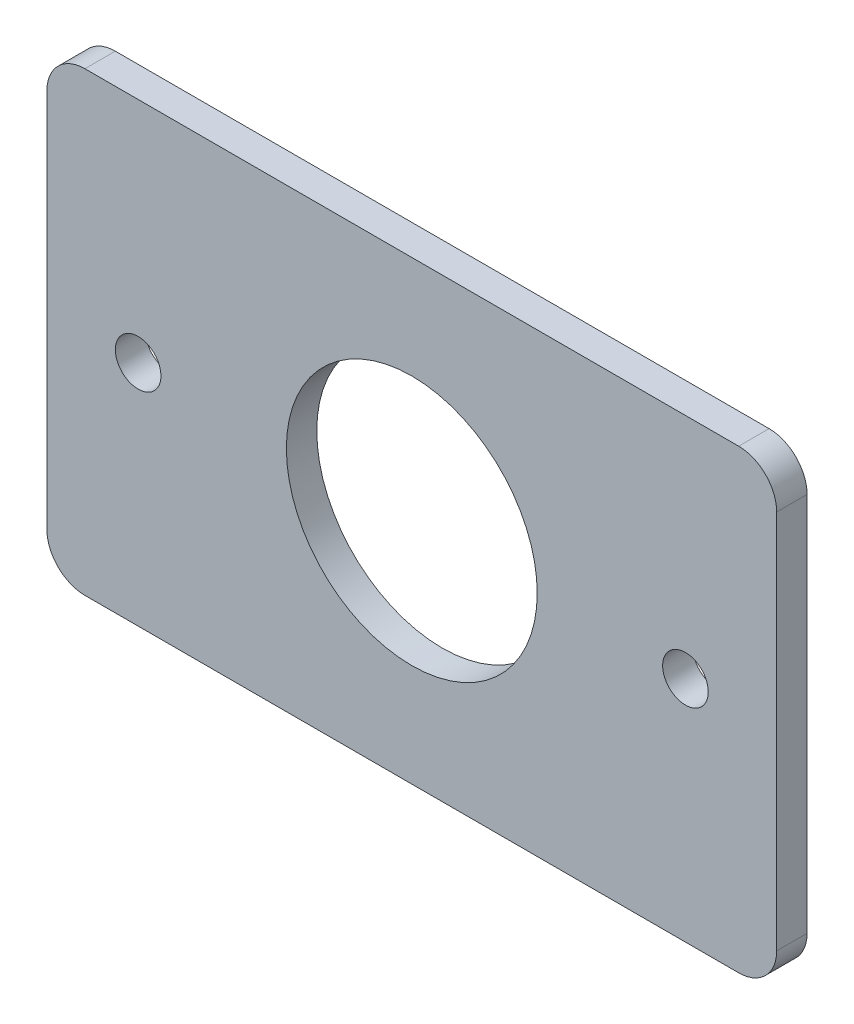
from build123d import *

# Parameters (mm, degrees)
MODEL_R             = 1.5
MODEL_R_2           = 8.25
BOSS_EXTRUDE1_DEPTH = 2


with BuildPart() as part:
    # Model → Boss-Extrude1 (new body)
    with BuildSketch(Plane.XY):
        with BuildLine():
            Line((-21.5, 30), (21.5, 30))
            ThreePointArc((21.5, 30), (23.267766953, 29.267766953), (24, 27.5))
            Line((24, 27.5), (24, 2.5))
            ThreePointArc((24, 2.5), (23.267766953, 0.732233047), (21.5, 0))
            Line((21.5, 0), (-21.5, 0))
            ThreePointArc((-21.5, 0), (-23.267766953, 0.732233047), (-24, 2.5))
            Line((-24, 2.5), (-24, 27.5))
            ThreePointArc((-24, 27.5), (-23.267766953, 29.267766953), (-21.5, 30))
        make_face()
        with Locations((18, 15)):
            Circle(MODEL_R, mode=Mode.SUBTRACT)
        with Locations(Location((-18, 15, 0), (0, 0, 180))):
            Circle(MODEL_R, mode=Mode.SUBTRACT)
        with Locations((0, 15)):
            Circle(MODEL_R_2, mode=Mode.SUBTRACT)
    extrude(amount=BOSS_EXTRUDE1_DEPTH)


solid = part.part
